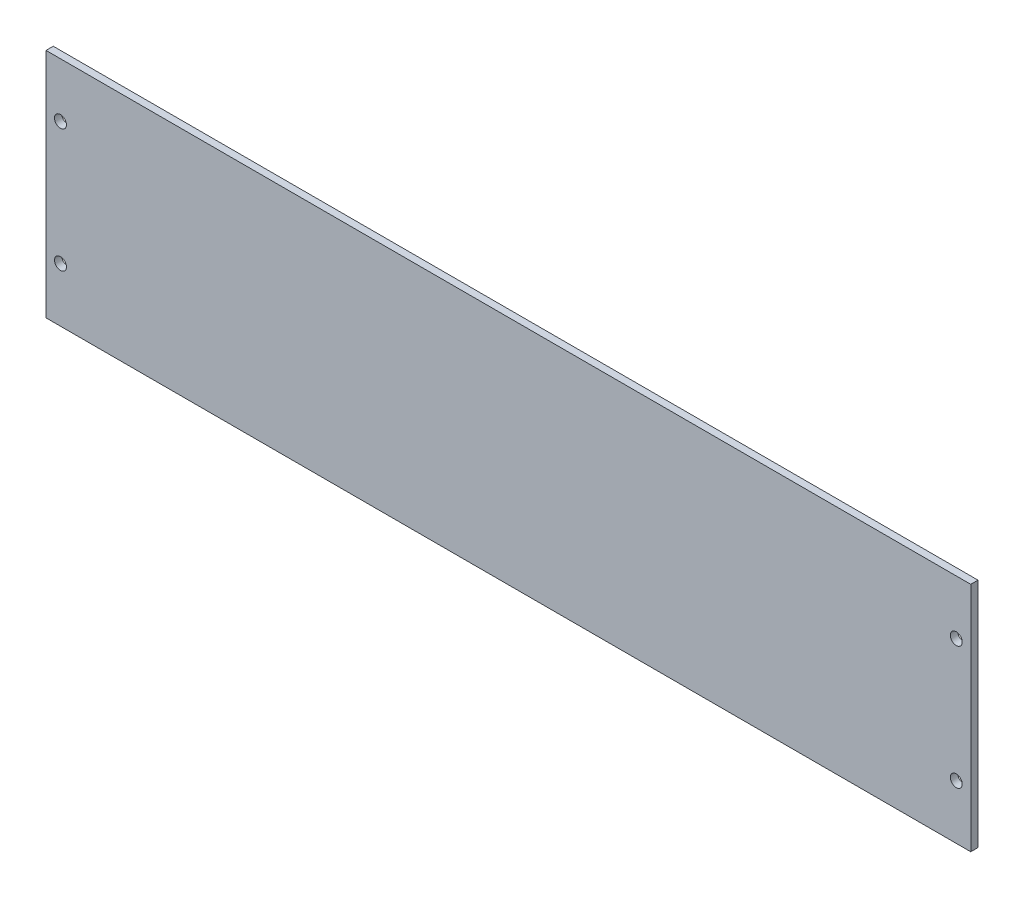
from build123d import *

# Parameters (mm, degrees)
ESQUISSE1_W        = 511
ESQUISSE1_H        = 128
BOSS_EXTRU_1_DEPTH = 4
D_GAGEMENT_M61_D   = 6.6


with BuildPart() as part:
    # Esquisse1 → Boss.-Extru.1 (new body)
    with BuildSketch(Plane.XY):
        Rectangle(ESQUISSE1_W, ESQUISSE1_H)
    extrude(amount=BOSS_EXTRU_1_DEPTH)

    # Dégagement M61 (through all)
    with Locations(Plane(origin=(-247.5, 34, 0), x_dir=(-1, 0, 0), z_dir=(0, 0, -1))):
        with Locations((0, 0), (0, -68), (-495, -68), (-495, 0)):
            Hole(D_GAGEMENT_M61_D / 2)


solid = part.part
